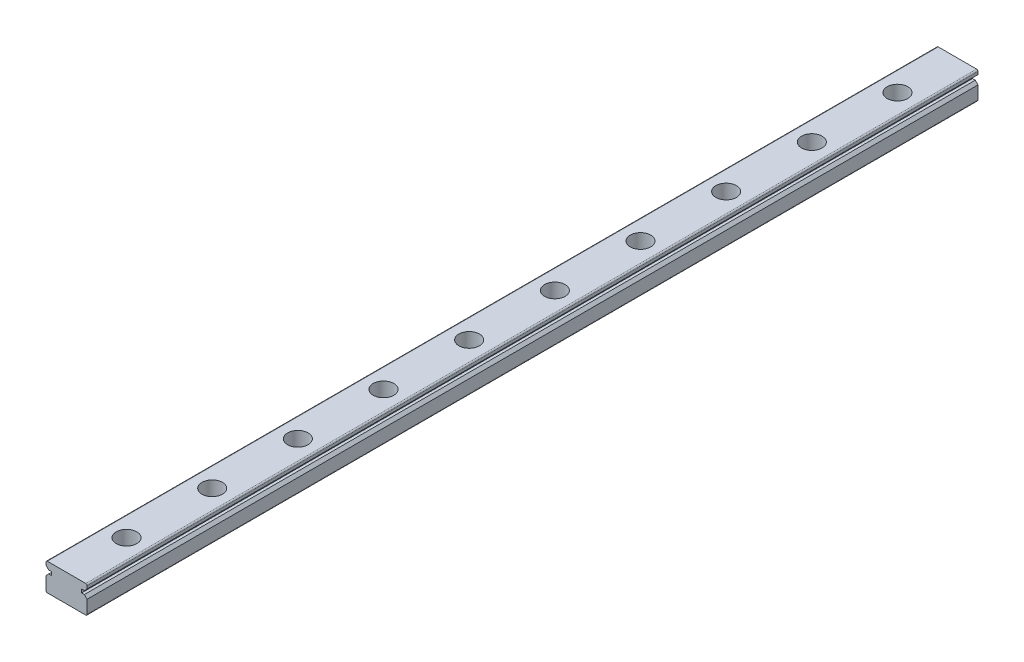
from build123d import *

# Parameters (mm, degrees)
BOSS_EXTRUDE1_DEPTH = 260
SKETCH2_R           = 3
CUT_EXTRUDE1_DEPTH  = 4.5
SKETCH3_R           = 1.75
CUT_EXTRUDE2_DEPTH  = 261.192236625


with BuildPart() as part:
    # Sketch1 → Boss-Extrude1 (new body)
    with BuildSketch(Plane.XY):
        with BuildLine():
            Line((-5.6, 4), (5.6, 4))
            ThreePointArc((5.6, 4), (5.882842712, 3.882842712), (6, 3.6))
            Line((6, 3.6), (6, 2.8))
            Line((6, 2.8), (5.2, 2))
            Line((5.2, 2), (4.4, 2))
            Line((4.4, 2), (4.4, 1))
            Line((4.4, 1), (5.2, 1))
            Line((5.2, 1), (6, 0.2))
            Line((6, 0.2), (6, -3.6))
            ThreePointArc((6, -3.6), (5.882842712, -3.882842712), (5.6, -4))
            Line((5.6, -4), (-5.6, -4))
            ThreePointArc((-5.6, -4), (-5.882842712, -3.882842712), (-6, -3.6))
            Line((-6, -3.6), (-6, 0.2))
            Line((-6, 0.2), (-5.2, 1))
            Line((-5.2, 1), (-4.4, 1))
            Line((-4.4, 1), (-4.4, 2))
            Line((-4.4, 2), (-5.2, 2))
            Line((-5.2, 2), (-6, 2.8))
            Line((-6, 2.8), (-6, 3.6))
            ThreePointArc((-6, 3.6), (-5.882842712, 3.882842712), (-5.6, 4))
        make_face()
    extrude(amount=BOSS_EXTRUDE1_DEPTH)

    # Sketch2 → Cut-Extrude1 (cut)
    with BuildSketch(Plane(origin=(0, 4, 0), x_dir=(1, 0, 0), z_dir=(0, 1, 0))):
        with Locations(Location((0, -242.5, 0), (0, 0, 270))):
            Circle(SKETCH2_R)
        with Locations(Location((0, -217.5, 0), (0, 0, 270))):
            Circle(SKETCH2_R)
        with Locations(Location((0, -192.5, 0), (0, 0, 270))):
            Circle(SKETCH2_R)
        with Locations(Location((0, -167.5, 0), (0, 0, 270))):
            Circle(SKETCH2_R)
        with Locations(Location((0, -142.5, 0), (0, 0, 270))):
            Circle(SKETCH2_R)
        with Locations(Location((0, -117.5, 0), (0, 0, 270))):
            Circle(SKETCH2_R)
        with Locations(Location((0, -92.5, 0), (0, 0, 270))):
            Circle(SKETCH2_R)
        with Locations(Location((0, -67.5, 0), (0, 0, 270))):
            Circle(SKETCH2_R)
        with Locations(Location((0, -42.5, 0), (0, 0, 270))):
            Circle(SKETCH2_R)
        with Locations(Location((0, -17.5, 0), (0, 0, 270))):
            Circle(SKETCH2_R)
        with Locations((0, 7.5)):
            Circle(SKETCH2_R)
        with Locations((0, 32.5)):
            Circle(SKETCH2_R)
        with Locations((0, 57.5)):
            Circle(SKETCH2_R)
        with Locations((0, 82.5)):
            Circle(SKETCH2_R)
        with Locations((0, 107.5)):
            Circle(SKETCH2_R)
        with Locations((0, 132.5)):
            Circle(SKETCH2_R)
        with Locations((0, 157.5)):
            Circle(SKETCH2_R)
        with Locations((0, 182.5)):
            Circle(SKETCH2_R)
    extrude(amount=-CUT_EXTRUDE1_DEPTH, mode=Mode.SUBTRACT)

    # Sketch3 → Cut-Extrude2 (cut, through all)
    with BuildSketch(Plane(origin=(0, 4, 0), x_dir=(1, 0, 0), z_dir=(0, 1, 0))):
        with Locations(Location((0, -242.5, 0), (0, 0, 270))):
            Circle(SKETCH3_R)
        with Locations(Location((0, -217.5, 0), (0, 0, 270))):
            Circle(SKETCH3_R)
        with Locations(Location((0, -192.5, 0), (0, 0, 270))):
            Circle(SKETCH3_R)
        with Locations(Location((0, -167.5, 0), (0, 0, 270))):
            Circle(SKETCH3_R)
        with Locations(Location((0, -142.5, 0), (0, 0, 270))):
            Circle(SKETCH3_R)
        with Locations(Location((0, -117.5, 0), (0, 0, 270))):
            Circle(SKETCH3_R)
        with Locations(Location((0, -92.5, 0), (0, 0, 270))):
            Circle(SKETCH3_R)
        with Locations(Location((0, -67.5, 0), (0, 0, 270))):
            Circle(SKETCH3_R)
        with Locations(Location((0, -42.5, 0), (0, 0, 270))):
            Circle(SKETCH3_R)
        with Locations(Location((0, -17.5, 0), (0, 0, 270))):
            Circle(SKETCH3_R)
        with Locations((0, 7.5)):
            Circle(SKETCH3_R)
        with Locations((0, 32.5)):
            Circle(SKETCH3_R)
        with Locations((0, 57.5)):
            Circle(SKETCH3_R)
        with Locations((0, 82.5)):
            Circle(SKETCH3_R)
        with Locations((0, 107.5)):
            Circle(SKETCH3_R)
    extrude(amount=-CUT_EXTRUDE2_DEPTH, mode=Mode.SUBTRACT)


solid = part.part
